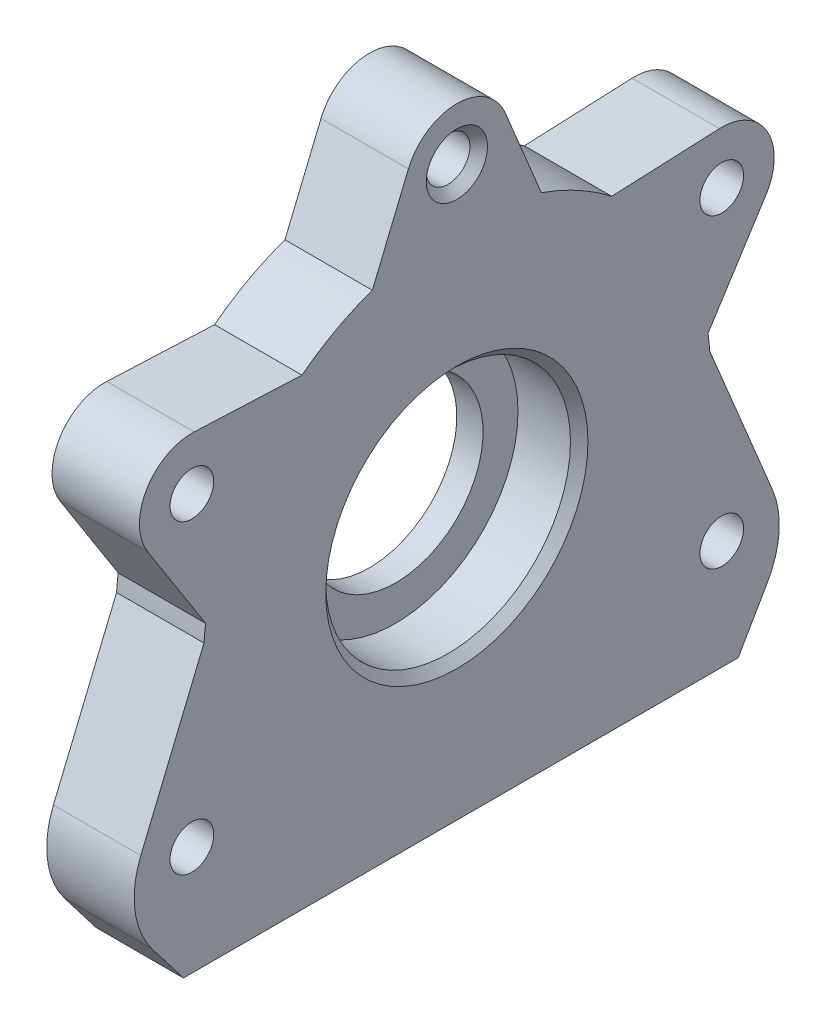
from build123d import *
from OCP.BRepFilletAPI import BRepFilletAPI_MakeChamfer

# Parameters (mm, degrees)
SKETCH_1_W                  = 10
SKETCH_1_H                  = 15
SKETCH_6_R                  = 14
SKETCH_6_R_2                = 10
EXTRUDE_1_DEPTH             = 3
SKETCH_7_R                  = 19.5
EXTRUDE_2_DEPTH             = 10
EXTRUDE_START               = -10
EXTRUDE_3_DEPTH             = 10
EXTRUDE_4_DEPTH             = 10
HOLE_WIZARD_M43_D           = 3.3
HOLE_WIZARD_M43_DEPTH       = 10
HOLE_WIZARD_M43_CSINK_D     = 5
HOLE_WIZARD_M43_CSINK_ANGLE = 90
HOLE_WIZARD_M43_TIP         = 0.991420021
HOLE_WIZARD_M61_D           = 5
HOLE_WIZARD_M61_CSINK_D     = 7
HOLE_WIZARD_M61_CSINK_ANGLE = 90
HOLE_WIZARD_M62_D           = 5
HOLE_WIZARD_M62_CSINK_D     = 7
HOLE_WIZARD_M62_CSINK_ANGLE = 90
CHAMFER_1_SIZE              = 1
CHAMFER_2_SIZE              = 10
CHAMFER_2_SIZE2             = 10.916011313
FILLET_1_R                  = 10


with BuildPart() as part:
    # Эскиз1 → Повернуть1 (revolve)
    with BuildSketch(Plane.XY, mode=Mode.PRIVATE) as revolve_1_sk:
        with Locations((5, 21.5)):
            Rectangle(SKETCH_1_W, SKETCH_1_H)
    revolve(revolve_1_sk.sketch.rotate(Axis((-29.36512031, 0, 0), (1, 0, 0)), 90), axis=Axis((-29.36512031, 0, 0), (1, 0, 0)))

    # Эскиз6 → Бобышка-Вытянуть1 (add)
    with BuildSketch(Plane.ZY):
        Circle(SKETCH_6_R)
        Circle(SKETCH_6_R_2, mode=Mode.SUBTRACT)
    extrude(amount=-EXTRUDE_1_DEPTH)

    # Эскиз7 → Бобышка-Вытянуть2 (add)
    with BuildSketch(Plane.ZY):
        with BuildLine():
            Line((-42.192192379, -30), (42.192192379, -30))
            Line((42.192192379, -30), (25.406687144, 10.52379439))
            ThreePointArc((25.406687144, 10.52379439), (0, 27.5), (-25.406687144, 10.52379439))
            Line((-25.406687144, 10.52379439), (-42.192192379, -30))
        make_face()
        Circle(SKETCH_7_R, mode=Mode.SUBTRACT)
    extrude(amount=-EXTRUDE_2_DEPTH)

    # Эскиз10 → Бобышка-Вытянуть3 (add)
    with BuildSketch(Plane.ZY.offset(EXTRUDE_START)):
        with BuildLine():
            Line((-35.371237807, 14.27620235), (-28.740816158, 3.868525117))
            ThreePointArc((-28.740816158, 3.868525117), (-25.11473671, 14.5), (-17.720649105, 22.95601436))
            Line((-17.720649105, 22.95601436), (-30.049172808, 23.494289329))
            ThreePointArc((-30.049172808, 23.494289329), (-35.507041555, 20.5), (-35.371237807, 14.27620235))
        make_face()
        with BuildLine():
            Line((30.049172808, 23.494289329), (17.720649105, 22.95601436))
            ThreePointArc((17.720649105, 22.95601436), (25.11473671, 14.5), (28.740816158, 3.868525117))
            Line((28.740816158, 3.868525117), (35.371237807, 14.27620235))
            ThreePointArc((35.371237807, 14.27620235), (35.507041555, 20.5), (30.049172808, 23.494289329))
        make_face()
    extrude(amount=EXTRUDE_3_DEPTH)

    # Эскиз14 → Бобышка-Вытянуть4 (add)
    with BuildSketch(Plane(origin=(10, 0, 0), x_dir=(0, 0, -1), z_dir=(1, 0, 0))):
        with BuildLine():
            Line((-5.543277195, 37.296100594), (-9.666616005, 27.341480118))
            ThreePointArc((-9.666616005, 27.341480118), (0, 29), (9.666616005, 27.341480118))
            Line((9.666616005, 27.341480118), (5.543277195, 37.296100594))
            ThreePointArc((5.543277195, 37.296100594), (0, 41), (-5.543277195, 37.296100594))
        make_face()
    extrude(amount=-EXTRUDE_4_DEPTH)

    # Отверстие обработанное метчиком M43
    with Locations(Plane(origin=(0, -30, 0), x_dir=(-1, 0, 0), z_dir=(0, -1, 0))):
        with Locations((-5, 0), (-5, 25), (-5, -25)):
            CounterSinkHole(HOLE_WIZARD_M43_D / 2, HOLE_WIZARD_M43_CSINK_D / 2, depth=HOLE_WIZARD_M43_DEPTH, counter_sink_angle=HOLE_WIZARD_M43_CSINK_ANGLE)
            with Locations((0, 0, -(HOLE_WIZARD_M43_DEPTH + HOLE_WIZARD_M43_TIP / 2))):  # 118° drill point
                Cone(0, HOLE_WIZARD_M43_D / 2, HOLE_WIZARD_M43_TIP, mode=Mode.SUBTRACT)

    # Отверстие обработанное метчиком M61 (through all)
    with Locations(Plane(origin=(0, 0, 0), x_dir=(0, 0, -1), z_dir=(-1, 0, 0))):
        with Locations((30.310889132, -17.5), (-30.310889132, -17.5), (-30.310889132, 17.5), (30.310889132, 17.5)):
            CounterSinkHole(HOLE_WIZARD_M61_D / 2, HOLE_WIZARD_M61_CSINK_D / 2, counter_sink_angle=HOLE_WIZARD_M61_CSINK_ANGLE)

    # Отверстие обработанное метчиком M62 (through all)
    with Locations(Plane(origin=(10, 0, 0), x_dir=(0, 0, -1), z_dir=(1, 0, 0))):
        with Locations((0, 35)):
            CounterSinkHole(HOLE_WIZARD_M62_D / 2, HOLE_WIZARD_M62_CSINK_D / 2, counter_sink_angle=HOLE_WIZARD_M62_CSINK_ANGLE)

    # Фаска1
    chamfer_1_edges = [part.edges().sort_by_distance(p)[0] for p in [
        (10, 0, -14),
    ]]
    chamfer(chamfer_1_edges, length=CHAMFER_1_SIZE)

    # Фаска2: one chamfer whose edges measure the first distance from different faces: ONE call of the kernel's chamfer builder (chamfer() names one face for all edges)
    chamfer_2_edges_1 = [part.edges().sort_by_distance(p)[0] for p in [
        (5, -30, -42.192192379),
    ]]
    chamfer_2_side_1 = [part.faces().sort_by_distance(p)[0] for p in [
        (5, -30, -41.342443923),
    ]]
    chamfer_2_edges_2 = [part.edges().sort_by_distance(p)[0] for p in [
        (5, -30, 42.192192379),
    ]]
    chamfer_2_side_2 = [part.faces().sort_by_distance(p)[0] for p in [
        (5, -13.990709354, 35.56092707),
    ]]
    chamfer_2 = BRepFilletAPI_MakeChamfer(part.part.solid().wrapped)
    for e in chamfer_2_edges_1:
        chamfer_2.Add(CHAMFER_2_SIZE, CHAMFER_2_SIZE2, e.wrapped, chamfer_2_side_1[0].wrapped)  # the first distance lies on this face
    for e in chamfer_2_edges_2:
        chamfer_2.Add(CHAMFER_2_SIZE, CHAMFER_2_SIZE2, e.wrapped, chamfer_2_side_2[0].wrapped)  # the first distance lies on this face
    add(Compound.cast(chamfer_2.Shape()), mode=Mode.REPLACE)

    # Скругление1
    fillet_1_edges = [part.edges().sort_by_distance(p)[0] for p in [
        (5, -20.761204675, 38.365358056),
        (5, -19.914920571, -38.014815702),
    ]]
    fillet(fillet_1_edges, radius=FILLET_1_R)


solid = part.part
